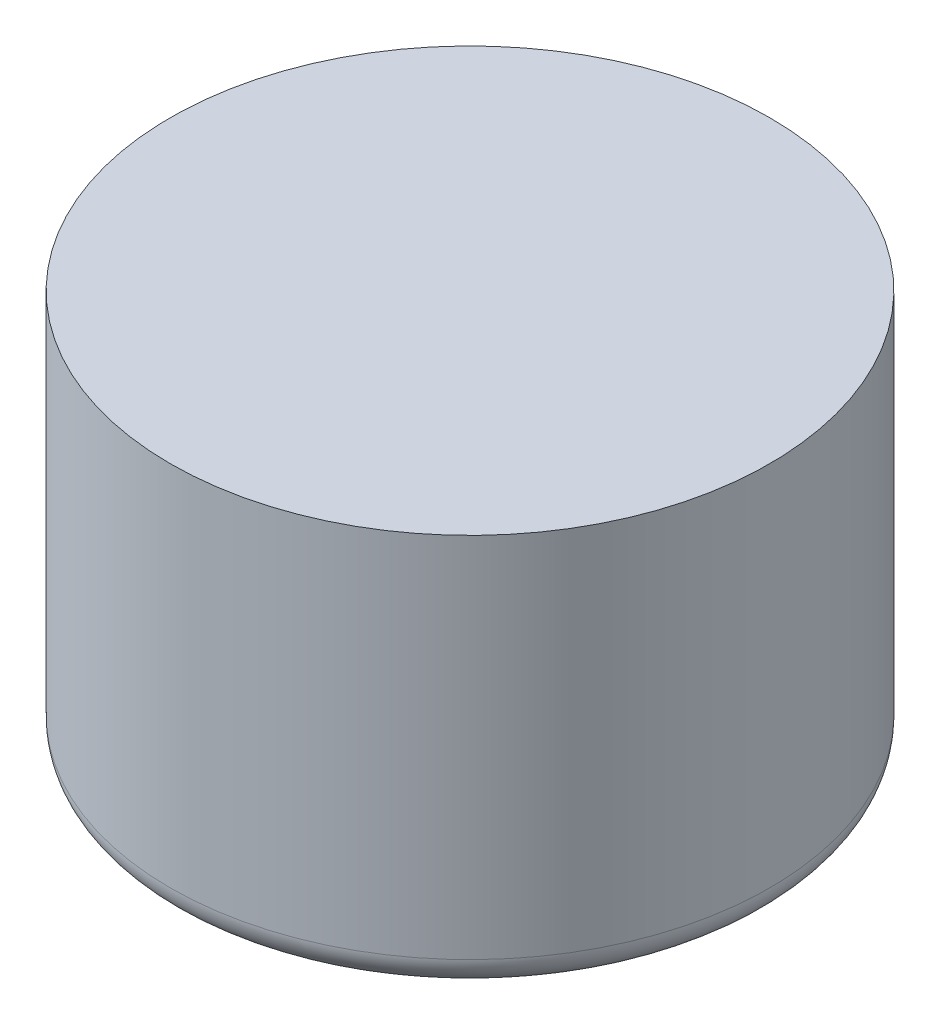
from build123d import *


with BuildPart() as part:
    # Sketch1 → Revolve1 (revolve)
    with BuildSketch(Plane.XY, mode=Mode.PRIVATE) as revolve1_sk:
        with BuildLine():
            Line((-24.27678, 32.258), (0, 32.258))
            Line((0, 32.258), (0, 0))
            Line((0, 0), (-21.77678, 0))
            ThreePointArc((-21.77678, 0), (-23.544546953, 0.732233047), (-24.27678, 2.5))
            Line((-24.27678, 2.5), (-24.27678, 32.258))
        make_face()
    revolve(revolve1_sk.sketch.rotate(Axis((0, -55, 0), (0, 1, 0)), 270), axis=Axis((0, -55, 0), (0, 1, 0)))


solid = part.part
